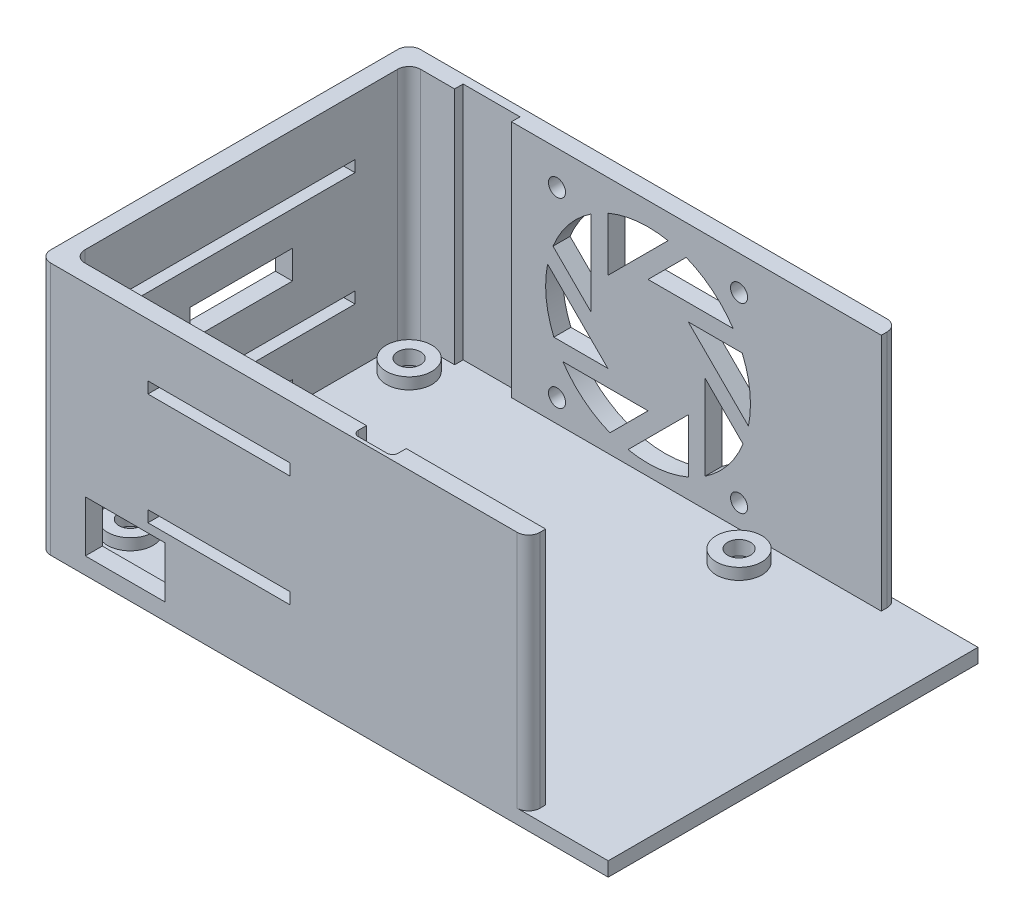
from build123d import *

# Parameters (mm, degrees)
SKETCH1_W           = 100
SKETCH1_H           = 65
BOSS_EXTRUDE1_DEPTH = 2.5
SKETCH2_R           = 2
CUT_EXTRUDE1_DEPTH  = 60.686681932
BOSS_EXTRUDE2_START = 2
SKETCH3_R           = 4
SKETCH3_R_2         = 2
BOSS_EXTRUDE2_DEPTH = 2
CUT_EXTRUDE2_DEPTH  = 2
SKETCH5_W           = 25
SKETCH5_H           = 18
CUT_EXTRUDE3_DEPTH  = 1
SKETCH6_W           = 86
SKETCH6_H           = 3
BOSS_EXTRUDE3_DEPTH = 42
CUT_EXTRUDE4_DEPTH  = 42
SKETCH8_W           = 3
SKETCH8_H           = 20.5
BOSS_EXTRUDE4_DEPTH = 42
SKETCH9_W           = 18
SKETCH9_H           = 15
SKETCH9_H_2         = 18
BOSS_EXTRUDE5_DEPTH = 3
CUT_EXTRUDE5_REACH  = 95.302
SKETCH12_W          = 25
SKETCH12_H          = 2
CUT_EXTRUDE7_REACH  = 95.302
SKETCH14_W          = 14
SKETCH14_H          = 9
FILLET1_R           = 2
SKETCH15_W          = 10
SKETCH15_H          = 1.5
CUT_EXTRUDE8_DEPTH  = 42
SKETCH16_W          = 40
SKETCH16_H          = 2
CUT_EXTRUDE9_DEPTH  = 3
CUT_EXTRUDE10_REACH = 95.302
SKETCH17_R          = 1.5
CUT_EXTRUDE11_REACH = 95.302


with BuildPart() as part:
    # Sketch1 → Boss-Extrude1 (new body)
    with BuildSketch(Plane(origin=(0, 0, 0), x_dir=(1, 0, 0), z_dir=(0, 1, 0))):
        Rectangle(SKETCH1_W, SKETCH1_H)
    extrude(amount=BOSS_EXTRUDE1_DEPTH)

    # Sketch2 → Cut-Extrude1 (cut, through all)
    with BuildSketch(Plane(origin=(0, 2.5, 0), x_dir=(1, 0, 0), z_dir=(0, 1, 0))):
        with Locations(Location((-42, 24.5, 0), (0, 0, 270))):
            Circle(SKETCH2_R)
        with Locations(Location((-42, -24.5, 0), (0, 0, 90))):
            Circle(SKETCH2_R)
        with Locations(Location((16, -24.5, 0), (0, 0, 270))):
            Circle(SKETCH2_R)
        with Locations(Location((16, 24.5, 0), (0, 0, 90))):
            Circle(SKETCH2_R)
    extrude(amount=-CUT_EXTRUDE1_DEPTH, mode=Mode.SUBTRACT)

    # Sketch3 → Boss-Extrude2 (add)
    # profile 1 of 4: a face of its own
    with BuildSketch(Plane(origin=(0, 2.5, 0), x_dir=(1, 0, 0), z_dir=(0, 1, 0)).offset(BOSS_EXTRUDE2_START)):
        with Locations(Location((-42, 24.5, 0), (0, 0, 270))):
            Circle(SKETCH3_R)
        with Locations(Location((-42, 24.5, 0), (0, 0, 270))):
            Circle(SKETCH3_R_2, mode=Mode.SUBTRACT)
    # profile 2 of 4: a face of its own
    with BuildSketch(Plane(origin=(0, 2.5, 0), x_dir=(1, 0, 0), z_dir=(0, 1, 0)).offset(BOSS_EXTRUDE2_START)):
        with Locations(Location((16, 24.5, 0), (0, 0, 270))):
            Circle(SKETCH3_R)
        with Locations(Location((16, 24.5, 0), (0, 0, 270))):
            Circle(SKETCH3_R_2, mode=Mode.SUBTRACT)
    # profile 3 of 4: a face of its own
    with BuildSketch(Plane(origin=(0, 2.5, 0), x_dir=(1, 0, 0), z_dir=(0, 1, 0)).offset(BOSS_EXTRUDE2_START)):
        with Locations(Location((16, -24.5, 0), (0, 0, 270))):
            Circle(SKETCH3_R)
        with Locations(Location((16, -24.5, 0), (0, 0, 270))):
            Circle(SKETCH3_R_2, mode=Mode.SUBTRACT)
    # profile 4 of 4: a face of its own
    with BuildSketch(Plane(origin=(0, 2.5, 0), x_dir=(1, 0, 0), z_dir=(0, 1, 0)).offset(BOSS_EXTRUDE2_START)):
        with Locations(Location((-42, -24.5, 0), (0, 0, 270))):
            Circle(SKETCH3_R)
        with Locations(Location((-42, -24.5, 0), (0, 0, 270))):
            Circle(SKETCH3_R_2, mode=Mode.SUBTRACT)
    extrude(amount=-BOSS_EXTRUDE2_DEPTH)

    # Sketch4 → Cut-Extrude2 (cut)
    with BuildSketch(Plane(origin=(0, 0, 0), x_dir=(-1, 0, 0), z_dir=(0, -1, 0))):
        Polygon((42, -28.108439182), (45.125, -26.304219591), (45.125, -22.695780409), (42, -20.891560818), (38.875, -22.695780409), (38.875, -26.304219591), align=None)
        Polygon((-12.875, -26.304219591), (-16, -28.108439182), (-19.125, -26.304219591), (-19.125, -22.695780409), (-16, -20.891560818), (-12.875, -22.695780409), align=None)
        Polygon((-19.125, 26.304219591), (-19.125, 22.695780409), (-16, 20.891560818), (-12.875, 22.695780409), (-12.875, 26.304219591), (-16, 28.108439182), align=None)
        Polygon((38.875, 26.304219591), (42, 28.108439182), (45.125, 26.304219591), (45.125, 22.695780409), (42, 20.891560818), (38.875, 22.695780409), align=None)
    extrude(amount=-CUT_EXTRUDE2_DEPTH, mode=Mode.SUBTRACT)

    # Sketch5 → Cut-Extrude3 (cut)
    with BuildSketch(Plane(origin=(0, 2.5, 0), x_dir=(1, 0, 0), z_dir=(0, 1, 0))):
        with Locations((-37.5, 0)):
            Rectangle(SKETCH5_W, SKETCH5_H)
    extrude(amount=-CUT_EXTRUDE3_DEPTH, mode=Mode.SUBTRACT)

    # Sketch6 → Boss-Extrude3 (add)
    with BuildSketch(Plane(origin=(0, 2.5, 0), x_dir=(1, 0, 0), z_dir=(0, 1, 0))):
        with Locations((-7, 31)):
            Rectangle(SKETCH6_W, SKETCH6_H)
        with Locations((-7, -31)):
            Rectangle(SKETCH6_W, SKETCH6_H)
    extrude(amount=BOSS_EXTRUDE3_DEPTH)

    # Sketch7 → Cut-Extrude4 (cut)
    with BuildSketch(Plane(origin=(0, 44.5, 0), x_dir=(1, 0, 0), z_dir=(0, 1, 0))):
        with BuildLine():
            Line((4.498762586, -27.1), (11.498762586, -27.1))
            Line((11.498762586, -27.1), (11.498762586, -30.9))
            ThreePointArc((11.498762586, -30.9), (11.205869367, -31.607106781), (10.498762586, -31.9))
            Line((10.498762586, -31.9), (5.498762586, -31.9))
            ThreePointArc((5.498762586, -31.9), (4.791655805, -31.607106781), (4.498762586, -30.9))
            Line((4.498762586, -30.9), (4.498762586, -27.1))
        make_face()
    extrude(amount=-CUT_EXTRUDE4_DEPTH, mode=Mode.SUBTRACT)

    # Sketch8 → Boss-Extrude4 (add)
    with BuildSketch(Plane(origin=(0, 2.5, 0), x_dir=(1, 0, 0), z_dir=(0, 1, 0))):
        with Locations((-48.5, 19.25)):
            Rectangle(SKETCH8_W, SKETCH8_H)
        with Locations((-48.5, -19.25)):
            Rectangle(SKETCH8_W, SKETCH8_H)
    extrude(amount=BOSS_EXTRUDE4_DEPTH)

    # Sketch9 → Boss-Extrude5 (add)
    with BuildSketch(Plane.ZY.offset(50)):
        with Locations((0, 14)):
            Rectangle(SKETCH9_W, SKETCH9_H)
        with Locations((0, 35.5)):
            Rectangle(SKETCH9_W, SKETCH9_H_2)
    extrude(amount=-BOSS_EXTRUDE5_DEPTH)

    # Sketch12 → Cut-Extrude5 (cut, up to next)
    with BuildSketch(Plane.XY.offset(32.5), mode=Mode.PRIVATE) as cut_extrude5_sk1:
        with Locations((-18.405944567, 14.5)):
            Rectangle(SKETCH12_W, SKETCH12_H)
    cut_extrude5_tool1 = extrude(cut_extrude5_sk1.sketch, amount=-CUT_EXTRUDE5_REACH, mode=Mode.PRIVATE) & part.part
    # Sketch12 → Cut-Extrude5 (cut, up to next)
    with BuildSketch(Plane.XY.offset(32.5), mode=Mode.PRIVATE) as cut_extrude5_sk2:
        with Locations((-18.405944567, 34.1)):
            Rectangle(SKETCH12_W, SKETCH12_H)
    cut_extrude5_tool2 = extrude(cut_extrude5_sk2.sketch, amount=-CUT_EXTRUDE5_REACH, mode=Mode.PRIVATE) & part.part
    add(cut_extrude5_tool1.solids().sort_by_distance((-18.405945, 14.5, 32.5))[0], mode=Mode.SUBTRACT)
    add(cut_extrude5_tool2.solids().sort_by_distance((-18.405945, 34.1, 32.5))[0], mode=Mode.SUBTRACT)

    # Sketch14 → Cut-Extrude7 (cut, up to next)
    with BuildSketch(Plane.XY.offset(32.5), mode=Mode.PRIVATE) as cut_extrude7_sk1:
        with Locations((-34.913733217, 7.45)):
            Rectangle(SKETCH14_W, SKETCH14_H)
    cut_extrude7_tool1 = extrude(cut_extrude7_sk1.sketch, amount=-CUT_EXTRUDE7_REACH, mode=Mode.PRIVATE) & part.part
    add(cut_extrude7_tool1.solids().sort_by_distance((-34.913733, 7.45, 32.5))[0], mode=Mode.SUBTRACT)

    # Fillet1
    fillet1_edges = [part.edges().sort_by_distance(p)[0] for p in [
        (36, 23.5, -32.5),
        (36, 23.5, 32.5),
        (-47, 23.5, -29.5),
        (-47, 23.5, 29.5),
        (-50, 22.25, 32.5),
        (-50, 22.25, -32.5),
    ]]
    fillet(fillet1_edges, radius=FILLET1_R)

    # Sketch15 → Cut-Extrude8 (cut)
    with BuildSketch(Plane(origin=(0, 44.5, 0), x_dir=(1, 0, 0), z_dir=(0, 1, 0))):
        with Locations((-34, 30.25)):
            Rectangle(SKETCH15_W, SKETCH15_H)
    extrude(amount=-CUT_EXTRUDE8_DEPTH, mode=Mode.SUBTRACT)

    # Sketch16 → Cut-Extrude9 (cut)
    with BuildSketch(Plane.ZY.offset(50)):
        with Locations((0, 13.5)):
            Rectangle(SKETCH16_W, SKETCH16_H)
        with Locations((0, 33.5)):
            Rectangle(SKETCH16_W, SKETCH16_H)
    extrude(amount=-CUT_EXTRUDE9_DEPTH, mode=Mode.SUBTRACT)

    # Sketch17 → Cut-Extrude10 (cut, up to next)
    with BuildSketch(Plane(origin=(0, 0, -32.5), x_dir=(-1, 0, 0), z_dir=(0, 0, -1)), mode=Mode.PRIVATE) as cut_extrude10_sk1:
        with Locations((-11, 38.5)):
            Circle(SKETCH17_R)
    cut_extrude10_tool1 = extrude(cut_extrude10_sk1.sketch, amount=-CUT_EXTRUDE10_REACH, mode=Mode.PRIVATE) & part.part
    # Sketch17 → Cut-Extrude10 (cut, up to next)
    with BuildSketch(Plane(origin=(0, 0, -32.5), x_dir=(-1, 0, 0), z_dir=(0, 0, -1)), mode=Mode.PRIVATE) as cut_extrude10_sk2:
        with Locations((21, 38.5)):
            Circle(SKETCH17_R)
    cut_extrude10_tool2 = extrude(cut_extrude10_sk2.sketch, amount=-CUT_EXTRUDE10_REACH, mode=Mode.PRIVATE) & part.part
    # Sketch17 → Cut-Extrude10 (cut, up to next)
    with BuildSketch(Plane(origin=(0, 0, -32.5), x_dir=(-1, 0, 0), z_dir=(0, 0, -1)), mode=Mode.PRIVATE) as cut_extrude10_sk3:
        with Locations((21, 6.5)):
            Circle(SKETCH17_R)
    cut_extrude10_tool3 = extrude(cut_extrude10_sk3.sketch, amount=-CUT_EXTRUDE10_REACH, mode=Mode.PRIVATE) & part.part
    # Sketch17 → Cut-Extrude10 (cut, up to next)
    with BuildSketch(Plane(origin=(0, 0, -32.5), x_dir=(-1, 0, 0), z_dir=(0, 0, -1)), mode=Mode.PRIVATE) as cut_extrude10_sk4:
        with Locations((-11, 6.5)):
            Circle(SKETCH17_R)
    cut_extrude10_tool4 = extrude(cut_extrude10_sk4.sketch, amount=-CUT_EXTRUDE10_REACH, mode=Mode.PRIVATE) & part.part
    add(cut_extrude10_tool1.solids().sort_by_distance((11, 38.5, -32.5))[0], mode=Mode.SUBTRACT)
    add(cut_extrude10_tool2.solids().sort_by_distance((-21, 38.5, -32.5))[0], mode=Mode.SUBTRACT)
    add(cut_extrude10_tool3.solids().sort_by_distance((-21, 6.5, -32.5))[0], mode=Mode.SUBTRACT)
    add(cut_extrude10_tool4.solids().sort_by_distance((11, 6.5, -32.5))[0], mode=Mode.SUBTRACT)

    # Sketch18 → Cut-Extrude11 (cut, up to next)
    with BuildSketch(Plane(origin=(0, 0, -32.5), x_dir=(-1, 0, 0), z_dir=(0, 0, -1)), mode=Mode.PRIVATE) as cut_extrude11_sk1:
        with BuildLine():
            Line((12.071067812, 29.571067812), (1.488062568, 40.154073056))
            ThreePointArc((1.488062568, 40.154073056), (6.862786305, 40.403352401), (12.071067812, 39.052945357))
            Line((12.071067812, 39.052945357), (12.071067812, 29.571067812))
        make_face()
    cut_extrude11_tool1 = extrude(cut_extrude11_sk1.sketch, amount=-CUT_EXTRUDE11_REACH, mode=Mode.PRIVATE) & part.part
    # Sketch18 → Cut-Extrude11 (cut, up to next)
    with BuildSketch(Plane(origin=(0, 0, -32.5), x_dir=(-1, 0, 0), z_dir=(0, 0, -1)), mode=Mode.PRIVATE) as cut_extrude11_sk2:
        with BuildLine():
            Line((15, 22.5), (15, 37.466629547))
            ThreePointArc((15, 37.466629547), (18.976770716, 33.842393061), (21.704699911, 29.204699911))
            Line((21.704699911, 29.204699911), (15, 22.5))
        make_face()
    cut_extrude11_tool2 = extrude(cut_extrude11_sk2.sketch, amount=-CUT_EXTRUDE11_REACH, mode=Mode.PRIVATE) & part.part
    # Sketch18 → Cut-Extrude11 (cut, up to next)
    with BuildSketch(Plane(origin=(0, 0, -32.5), x_dir=(-1, 0, 0), z_dir=(0, 0, -1)), mode=Mode.PRIVATE) as cut_extrude11_sk3:
        with BuildLine():
            Line((12.071067812, 15.428932188), (22.654073056, 26.011937432))
            ThreePointArc((22.654073056, 26.011937432), (22.903352401, 20.637213695), (21.552945357, 15.428932188))
            Line((21.552945357, 15.428932188), (12.071067812, 15.428932188))
        make_face()
    cut_extrude11_tool3 = extrude(cut_extrude11_sk3.sketch, amount=-CUT_EXTRUDE11_REACH, mode=Mode.PRIVATE) & part.part
    # Sketch18 → Cut-Extrude11 (cut, up to next)
    with BuildSketch(Plane(origin=(0, 0, -32.5), x_dir=(-1, 0, 0), z_dir=(0, 0, -1)), mode=Mode.PRIVATE) as cut_extrude11_sk4:
        with BuildLine():
            Line((5, 12.5), (19.966629547, 12.5))
            ThreePointArc((19.966629547, 12.5), (16.342393061, 8.523229284), (11.704699911, 5.795300089))
            Line((11.704699911, 5.795300089), (5, 12.5))
        make_face()
    cut_extrude11_tool4 = extrude(cut_extrude11_sk4.sketch, amount=-CUT_EXTRUDE11_REACH, mode=Mode.PRIVATE) & part.part
    # Sketch18 → Cut-Extrude11 (cut, up to next)
    with BuildSketch(Plane(origin=(0, 0, -32.5), x_dir=(-1, 0, 0), z_dir=(0, 0, -1)), mode=Mode.PRIVATE) as cut_extrude11_sk5:
        with BuildLine():
            Line((-2.071067812, 15.428932188), (8.511937432, 4.845926944))
            ThreePointArc((8.511937432, 4.845926944), (3.137213695, 4.596647599), (-2.071067812, 5.947054643))
            Line((-2.071067812, 5.947054643), (-2.071067812, 15.428932188))
        make_face()
    cut_extrude11_tool5 = extrude(cut_extrude11_sk5.sketch, amount=-CUT_EXTRUDE11_REACH, mode=Mode.PRIVATE) & part.part
    # Sketch18 → Cut-Extrude11 (cut, up to next)
    with BuildSketch(Plane(origin=(0, 0, -32.5), x_dir=(-1, 0, 0), z_dir=(0, 0, -1)), mode=Mode.PRIVATE) as cut_extrude11_sk6:
        with BuildLine():
            Line((-5, 22.5), (-5, 7.533370453))
            ThreePointArc((-5, 7.533370453), (-8.976770716, 11.157606939), (-11.704699911, 15.795300089))
            Line((-11.704699911, 15.795300089), (-5, 22.5))
        make_face()
    cut_extrude11_tool6 = extrude(cut_extrude11_sk6.sketch, amount=-CUT_EXTRUDE11_REACH, mode=Mode.PRIVATE) & part.part
    # Sketch18 → Cut-Extrude11 (cut, up to next)
    with BuildSketch(Plane(origin=(0, 0, -32.5), x_dir=(-1, 0, 0), z_dir=(0, 0, -1)), mode=Mode.PRIVATE) as cut_extrude11_sk7:
        with BuildLine():
            Line((5, 32.5), (-9.966629547, 32.5))
            ThreePointArc((-9.966629547, 32.5), (-6.342393061, 36.476770716), (-1.704699911, 39.204699911))
            Line((-1.704699911, 39.204699911), (5, 32.5))
        make_face()
    cut_extrude11_tool7 = extrude(cut_extrude11_sk7.sketch, amount=-CUT_EXTRUDE11_REACH, mode=Mode.PRIVATE) & part.part
    # Sketch18 → Cut-Extrude11 (cut, up to next)
    with BuildSketch(Plane(origin=(0, 0, -32.5), x_dir=(-1, 0, 0), z_dir=(0, 0, -1)), mode=Mode.PRIVATE) as cut_extrude11_sk8:
        with BuildLine():
            Line((-2.071067812, 29.571067812), (-12.654073056, 18.988062568))
            ThreePointArc((-12.654073056, 18.988062568), (-12.903352401, 24.362786305), (-11.552945357, 29.571067812))
            Line((-11.552945357, 29.571067812), (-2.071067812, 29.571067812))
        make_face()
    cut_extrude11_tool8 = extrude(cut_extrude11_sk8.sketch, amount=-CUT_EXTRUDE11_REACH, mode=Mode.PRIVATE) & part.part
    add(cut_extrude11_tool1.solids().sort_by_distance((-8.366021, 36.635002, -32.5))[0], mode=Mode.SUBTRACT)
    add(cut_extrude11_tool2.solids().sort_by_distance((-17.375092, 30.114819, -32.5))[0], mode=Mode.SUBTRACT)
    add(cut_extrude11_tool3.solids().sort_by_distance((-19.135002, 19.133979, -32.5))[0], mode=Mode.SUBTRACT)
    add(cut_extrude11_tool4.solids().sort_by_distance((-12.614819, 10.124908, -32.5))[0], mode=Mode.SUBTRACT)
    add(cut_extrude11_tool5.solids().sort_by_distance((-1.633979, 8.364998, -32.5))[0], mode=Mode.SUBTRACT)
    add(cut_extrude11_tool6.solids().sort_by_distance((7.375092, 14.885181, -32.5))[0], mode=Mode.SUBTRACT)
    add(cut_extrude11_tool7.solids().sort_by_distance((2.614819, 34.875092, -32.5))[0], mode=Mode.SUBTRACT)
    add(cut_extrude11_tool8.solids().sort_by_distance((9.135002, 25.866021, -32.5))[0], mode=Mode.SUBTRACT)


solid = part.part
